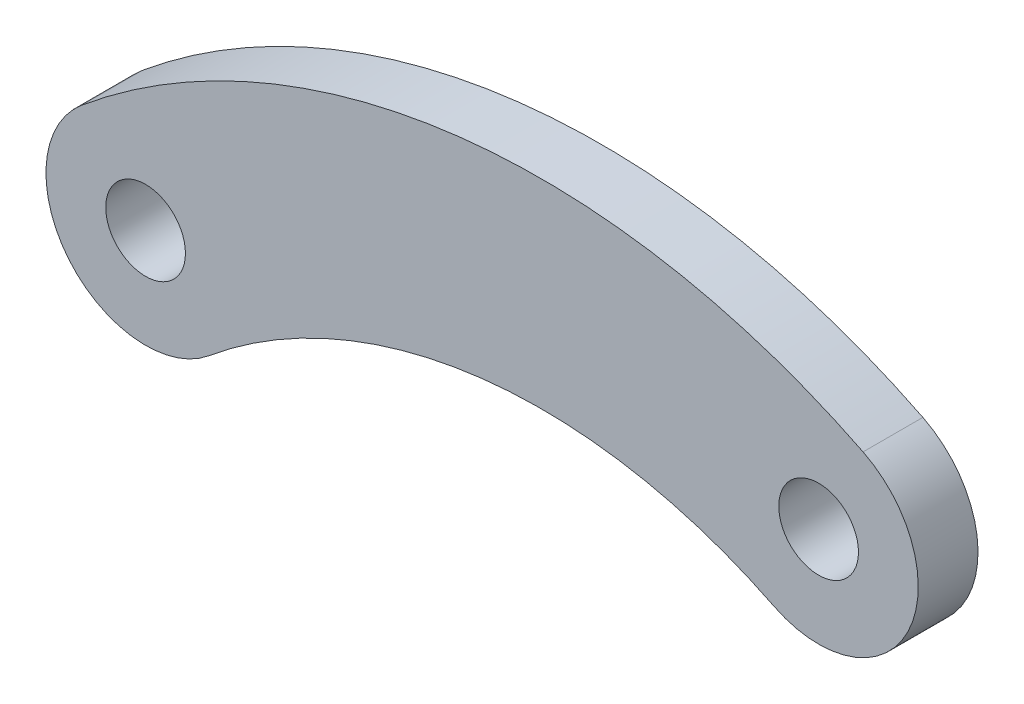
from build123d import *

# Parameters (mm, degrees)
SKETCH1_R           = 1
BOSS_EXTRUDE1_DEPTH = 1.5


with BuildPart() as part:
    # Sketch1 → Boss-Extrude1 (new body)
    with BuildSketch(Plane.XY):
        with BuildLine():
            ThreePointArc((18.003754912, 4.188278926), (7.86689461, 5.968823142), (-1.596835619, 1.92356856))
            ThreePointArc((-1.596835619, 1.92356856), (-1.92356856, -1.596835619), (1.596835619, -1.92356856))
            ThreePointArc((1.596835619, -1.92356856), (8.440791329, 1.001868083), (15.771539488, -0.285781233))
            ThreePointArc((15.771539488, -0.285781233), (19.124677279, 0.835141134), (18.003754912, 4.188278926))
        make_face()
        Circle(SKETCH1_R, mode=Mode.SUBTRACT)
        with Locations((16.8876472, 1.951248846)):
            Circle(SKETCH1_R, mode=Mode.SUBTRACT)
    extrude(amount=BOSS_EXTRUDE1_DEPTH)


solid = part.part
